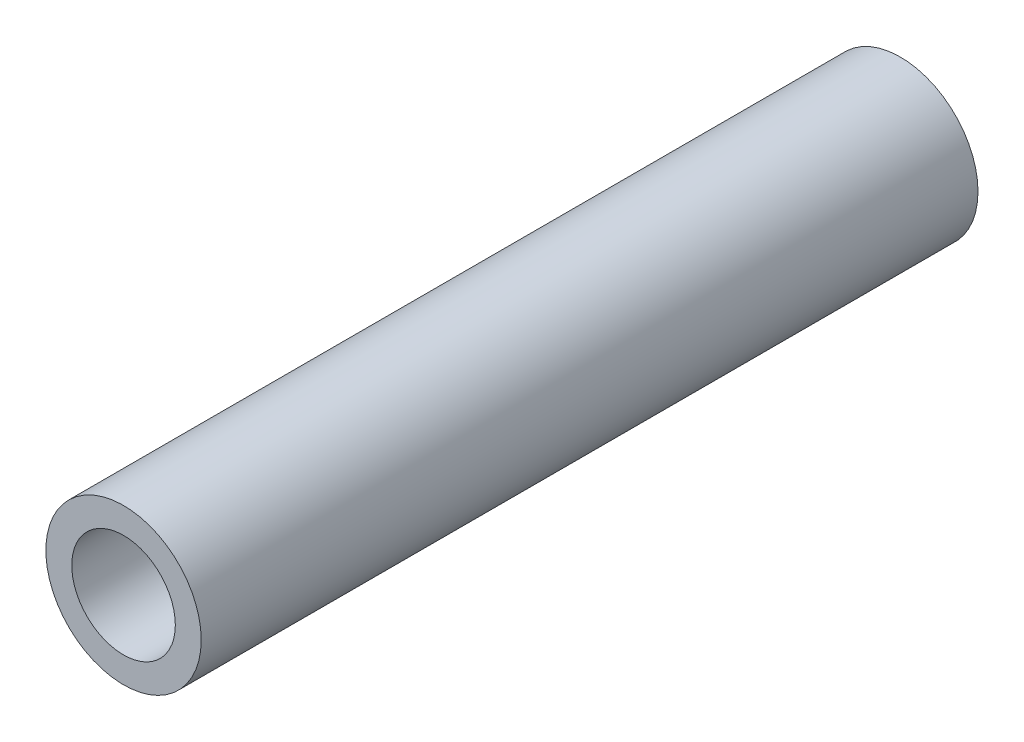
from build123d import *

# Parameters (mm, degrees)
SKETCH_1_R      = 3
SKETCH_1_R_2    = 2
EXTRUDE_1_DEPTH = 15


with BuildPart() as part:
    # 草图1 → 凸台-拉伸1 (new, symmetric)
    with BuildSketch(Plane.XY):
        Circle(SKETCH_1_R)
        Circle(SKETCH_1_R_2, mode=Mode.SUBTRACT)
    extrude(amount=EXTRUDE_1_DEPTH, both=True)


solid = part.part
